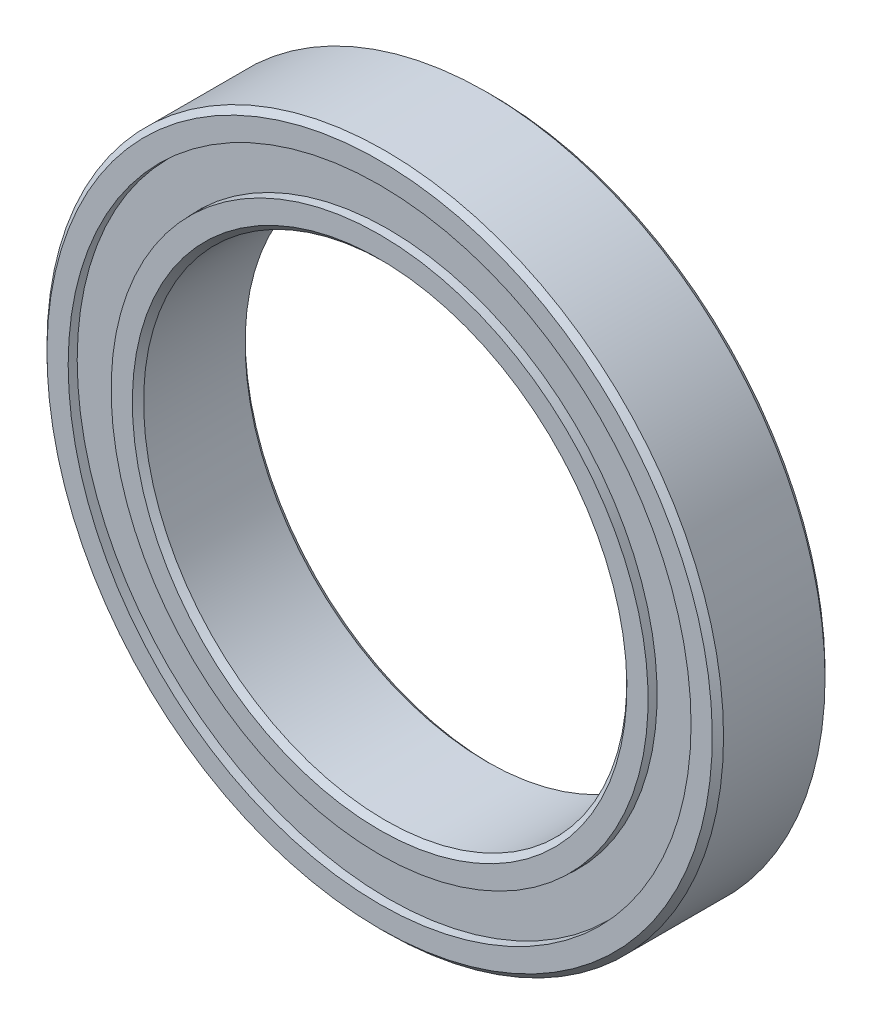
from build123d import *

# Parameters (mm, degrees)
SKETCH5_W         = 0.381
SKETCH5_H         = 2.615866666
CIRPATTERN1_COUNT = 17


with BuildPart() as part:
    # Sketch5 → Revolve1 (revolve)
    with BuildSketch(Plane(origin=(0, 0, 0), x_dir=(0, 0, -1), z_dir=(1, 0, 0)), mode=Mode.PRIVATE) as revolve1_sk:
        with BuildLine():
            Line((3.15, 21), (-3.15, 21))
            Line((-3.15, 21), (-3.5, 20.65))
            Line((-3.5, 20.65), (-3.5, 19.333333333))
            Line((-3.5, 19.333333333), (-1.555555556, 19.333333333))
            ThreePointArc((-1.555555556, 19.333333333), (0, 20.048787657), (1.555555556, 19.333333333))
            Line((1.555555556, 19.333333333), (3.5, 19.333333333))
            Line((3.5, 19.333333333), (3.5, 20.65))
            Line((3.5, 20.65), (3.15, 21))
        make_face()
        with Locations((2.774393829, 18)):
            Rectangle(SKETCH5_W, SKETCH5_H)
        with Locations((-2.774393829, 18)):
            Rectangle(SKETCH5_W, SKETCH5_H)
    revolve(revolve1_sk.sketch.rotate(Axis((0, 0, 3.5), (0, 0, -1)), 180), axis=Axis((0, 0, 3.5), (0, 0, -1)))


with BuildPart() as body_2:
    # Sketch3 → Revolve3 (revolve)
    with BuildSketch(Plane(origin=(0, 0, 0), x_dir=(0, 0, -1), z_dir=(1, 0, 0)), mode=Mode.PRIVATE) as revolve3_sk:
        with BuildLine():
            Line((-3.5, 16.666666667), (-1.555555556, 16.666666667))
            ThreePointArc((-1.555555556, 16.666666667), (0, 15.951212343), (1.555555556, 16.666666667))
            Line((1.555555556, 16.666666667), (3.5, 16.666666667))
            Line((3.5, 16.666666667), (3.5, 15.35))
            Line((3.5, 15.35), (3.15, 15))
            Line((3.15, 15), (-3.15, 15))
            Line((-3.15, 15), (-3.5, 15.35))
            Line((-3.5, 15.35), (-3.5, 16.666666667))
        make_face()
    revolve(revolve3_sk.sketch.rotate(Axis((0, 0, 3.5), (0, 0, -1)), 180), axis=Axis((0, 0, 3.5), (0, 0, -1)))


with BuildPart() as body_3:
    # Sketch4 → Revolve4 (revolve)
    with BuildSketch(Plane(origin=(0, 0, 0), x_dir=(0, 0, -1), z_dir=(1, 0, 0))):
        with BuildLine():
            Line((-2.048787657, 18), (2.048787657, 18))
            ThreePointArc((2.048787657, 18), (0, 20.048787657), (-2.048787657, 18))
        make_face()
    revolve(axis=Axis((0, 18, 2.048787657), (0, 0, -1)))


with BuildPart() as cirpattern1_1:
    # CirPattern1: pattern copy
    add(body_3.part.rotate(Axis((0, 0, 0), (0, 0, 1)), 1 * 360 / CIRPATTERN1_COUNT))


with BuildPart() as cirpattern1_2:
    # CirPattern1: pattern copy
    add(body_3.part.rotate(Axis((0, 0, 0), (0, 0, 1)), 2 * 360 / CIRPATTERN1_COUNT))


with BuildPart() as cirpattern1_3:
    # CirPattern1: pattern copy
    add(body_3.part.rotate(Axis((0, 0, 0), (0, 0, 1)), 3 * 360 / CIRPATTERN1_COUNT))


with BuildPart() as cirpattern1_4:
    # CirPattern1: pattern copy
    add(body_3.part.rotate(Axis((0, 0, 0), (0, 0, 1)), 4 * 360 / CIRPATTERN1_COUNT))


with BuildPart() as cirpattern1_5:
    # CirPattern1: pattern copy
    add(body_3.part.rotate(Axis((0, 0, 0), (0, 0, 1)), 5 * 360 / CIRPATTERN1_COUNT))


with BuildPart() as cirpattern1_6:
    # CirPattern1: pattern copy
    add(body_3.part.rotate(Axis((0, 0, 0), (0, 0, 1)), 6 * 360 / CIRPATTERN1_COUNT))


with BuildPart() as cirpattern1_7:
    # CirPattern1: pattern copy
    add(body_3.part.rotate(Axis((0, 0, 0), (0, 0, 1)), 7 * 360 / CIRPATTERN1_COUNT))


with BuildPart() as cirpattern1_8:
    # CirPattern1: pattern copy
    add(body_3.part.rotate(Axis((0, 0, 0), (0, 0, 1)), 8 * 360 / CIRPATTERN1_COUNT))


with BuildPart() as cirpattern1_9:
    # CirPattern1: pattern copy
    add(body_3.part.rotate(Axis((0, 0, 0), (0, 0, 1)), 9 * 360 / CIRPATTERN1_COUNT))


with BuildPart() as cirpattern1_10:
    # CirPattern1: pattern copy
    add(body_3.part.rotate(Axis((0, 0, 0), (0, 0, 1)), 10 * 360 / CIRPATTERN1_COUNT))


with BuildPart() as cirpattern1_11:
    # CirPattern1: pattern copy
    add(body_3.part.rotate(Axis((0, 0, 0), (0, 0, 1)), 11 * 360 / CIRPATTERN1_COUNT))


with BuildPart() as cirpattern1_12:
    # CirPattern1: pattern copy
    add(body_3.part.rotate(Axis((0, 0, 0), (0, 0, 1)), 12 * 360 / CIRPATTERN1_COUNT))


with BuildPart() as cirpattern1_13:
    # CirPattern1: pattern copy
    add(body_3.part.rotate(Axis((0, 0, 0), (0, 0, 1)), 13 * 360 / CIRPATTERN1_COUNT))


with BuildPart() as cirpattern1_14:
    # CirPattern1: pattern copy
    add(body_3.part.rotate(Axis((0, 0, 0), (0, 0, 1)), 14 * 360 / CIRPATTERN1_COUNT))


with BuildPart() as cirpattern1_15:
    # CirPattern1: pattern copy
    add(body_3.part.rotate(Axis((0, 0, 0), (0, 0, 1)), 15 * 360 / CIRPATTERN1_COUNT))


with BuildPart() as cirpattern1_16:
    # CirPattern1: pattern copy
    add(body_3.part.rotate(Axis((0, 0, 0), (0, 0, 1)), 16 * 360 / CIRPATTERN1_COUNT))


solid = Compound([part.part, body_2.part, body_3.part, cirpattern1_1.part, cirpattern1_2.part, cirpattern1_3.part, cirpattern1_4.part, cirpattern1_5.part, cirpattern1_6.part, cirpattern1_7.part, cirpattern1_8.part, cirpattern1_9.part, cirpattern1_10.part, cirpattern1_11.part, cirpattern1_12.part, cirpattern1_13.part, cirpattern1_14.part, cirpattern1_15.part, cirpattern1_16.part])
